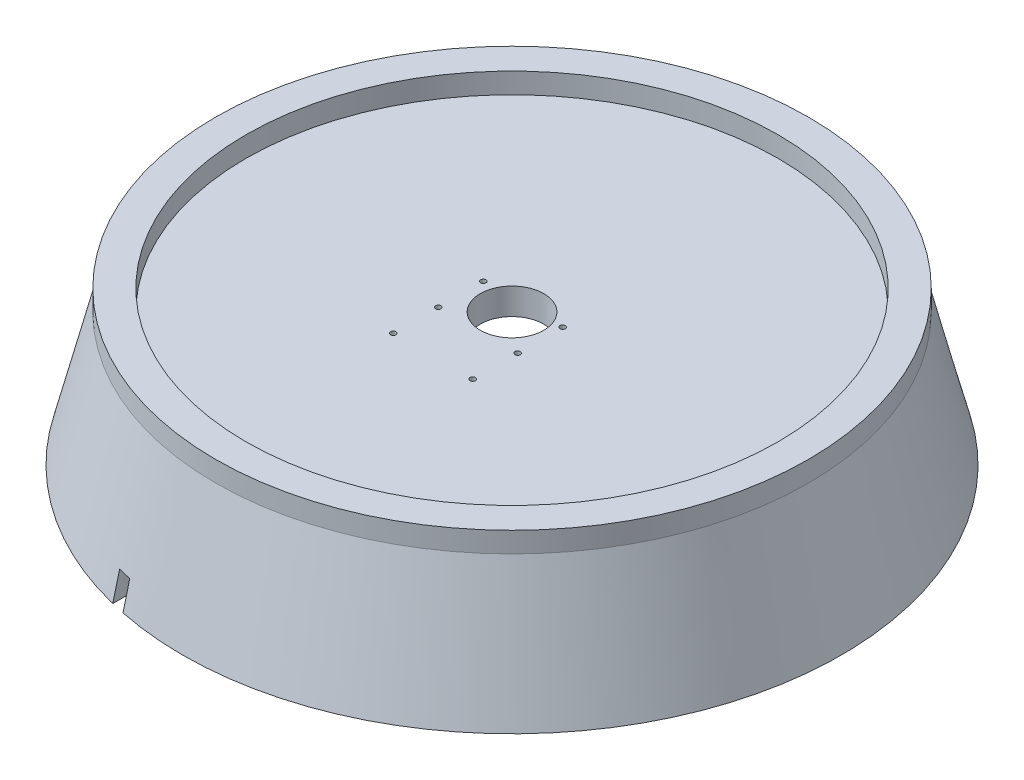
from build123d import *

# Parameters (mm, degrees)
SKETCH10_R              = 1.025
CUT_EXTRUDE2_DEPTH      = 10
SKETCH11_R              = 112
SKETCH11_R_2            = 100.5
BOSS_EXTRUDE1_DEPTH     = 7.75
BOSS_EXTRUDE2_DEPTH     = 20
CIRPATTERN1_COUNT       = 5
CUT_EXTRUDE3_DEPTH      = 285.75526773
CUT_EXTRUDE3_DEPTH_BACK = 285.75526773
SKETCH14_W              = 5
SKETCH14_H              = 10


with BuildPart() as part:
    # Sketch4 → Revolve1 (revolve)
    with BuildSketch(Plane.XY, mode=Mode.PRIVATE) as revolve1_sk:
        Polygon((12, 50), (12, 40), (104.192235936, 40), (104.192235936, 0), (124.5, 0), (112, 50), align=None)
    revolve(revolve1_sk.sketch.rotate(Axis((0, 0, 0), (0, 1, 0)), 90), axis=Axis((0, 0, 0), (0, 1, 0)))

    # Sketch10 → Cut-Extrude2 (cut)
    with BuildSketch(Plane.XZ.offset(-40)):
        with Locations(Location((14.55, 12.4, 0), (0, 0, 270))):
            Circle(SKETCH10_R)
        with Locations(Location((-15.45, 12.4, 0), (0, 0, 270))):
            Circle(SKETCH10_R)
        with Locations(Location((-15.45, 29.4, 0), (0, 0, 270))):
            Circle(SKETCH10_R)
        with Locations(Location((14.55, 29.4, 0), (0, 0, 270))):
            Circle(SKETCH10_R)
        with Locations(Location((14.55, -4.6, 0), (0, 0, 270))):
            Circle(SKETCH10_R)
        with Locations(Location((-15.45, -4.6, 0), (0, 0, 270))):
            Circle(SKETCH10_R)
    extrude(amount=-CUT_EXTRUDE2_DEPTH, mode=Mode.SUBTRACT)

    # Sketch11 → Boss-Extrude1 (add)
    with BuildSketch(Plane(origin=(0, 50, 0), x_dir=(1, 0, 0), z_dir=(0, 1, 0))):
        with Locations(Location((0, 0, 0), (0, 0, 270))):
            Circle(SKETCH11_R)
        with Locations(Location((0, 0, 0), (0, 0, 270))):
            Circle(SKETCH11_R_2, mode=Mode.SUBTRACT)
    extrude(amount=BOSS_EXTRUDE1_DEPTH)

    # Sketch13 → Boss-Extrude2 (add, symmetric)
    with BuildSketch(Plane.XY):
        with BuildLine():
            ThreePointArc((84.192235936, 10), (75.405439372, 31.213203436), (54.192235936, 40))
            Line((54.192235936, 40), (104.192235936, 40))
            Line((104.192235936, 40), (104.192235936, 0))
            Line((104.192235936, 0), (84.192235936, 0))
            Line((84.192235936, 0), (84.192235936, 10))
        make_face()
    boss_extrude2 = extrude(amount=BOSS_EXTRUDE2_DEPTH, both=True)

    # CirPattern1: Boss-Extrude2 ×5 about axis
    cirpattern1_axis = Axis((0, 0, 0), (0, 1, 0))
    for i in range(1, CIRPATTERN1_COUNT):
        add(boss_extrude2.rotate(cirpattern1_axis, i * 360 / CIRPATTERN1_COUNT))

    # Sketch14 → Cut-Extrude3 (cut, two sides: drawn at the far end of the back side and taken through both)
    with BuildSketch(Plane.XY.offset(125).offset(-CUT_EXTRUDE3_DEPTH_BACK)):
        with Locations((-27.5, 5)):
            Rectangle(SKETCH14_W, SKETCH14_H)
    extrude(amount=CUT_EXTRUDE3_DEPTH + CUT_EXTRUDE3_DEPTH_BACK, mode=Mode.SUBTRACT)


solid = part.part
